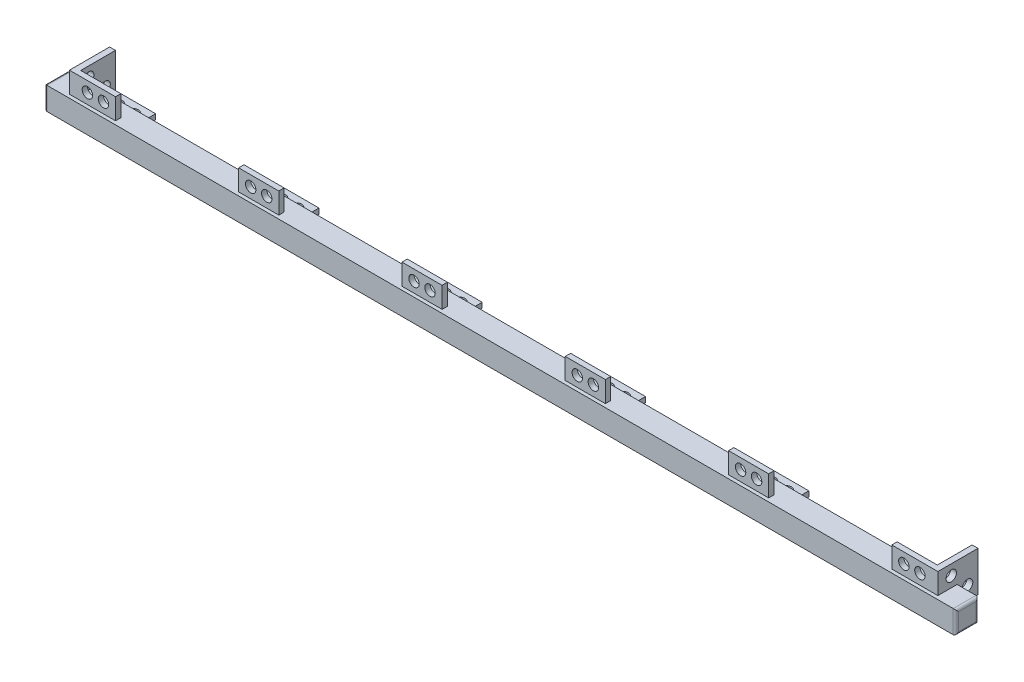
from build123d import *

# Parameters (mm, degrees)
SKETCH1_W           = 8.5
SKETCH1_H           = 8.5
BOSS_EXTRUDE1_DEPTH = 340.5
SKETCH2_W           = 15
SKETCH2_H           = 2
BOSS_EXTRUDE2_DEPTH = 7.8
SKETCH3_R           = 1.95
CUT_EXTRUDE1_DEPTH  = 7.8
SKETCH4_W           = 15
SKETCH4_H           = 2
BOSS_EXTRUDE3_DEPTH = 7.8
SKETCH5_R           = 1.95
CUT_EXTRUDE2_DEPTH  = 7.8
FILLET1_R           = 1
FILLET3_R           = 1
BOSS_EXTRUDE5_DEPTH = 2.2
BOSS_EXTRUDE6_DEPTH = 2.2
SKETCH9_R           = 1.95
CUT_EXTRUDE3_DEPTH  = 350


with BuildPart() as part:
    # Sketch1 → Boss-Extrude1 (new body)
    with BuildSketch(Plane(origin=(0, 0, 0), x_dir=(0, 0, -1), z_dir=(1, 0, 0))):
        with Locations((4.25, 4.25)):
            Rectangle(SKETCH1_W, SKETCH1_H)
    extrude(amount=BOSS_EXTRUDE1_DEPTH)

    # Sketch2 → Boss-Extrude2 (add)
    with BuildSketch(Plane(origin=(0, 8.5, 0), x_dir=(1, 0, 0), z_dir=(0, 1, 0))):
        with Locations((17.75, 2.3)):
            Rectangle(SKETCH2_W, SKETCH2_H)
        with Locations((78.75, 2.3)):
            Rectangle(SKETCH2_W, SKETCH2_H)
        with Locations((139.75, 2.3)):
            Rectangle(SKETCH2_W, SKETCH2_H)
        with Locations((200.75, 2.3)):
            Rectangle(SKETCH2_W, SKETCH2_H)
        with Locations((261.75, 2.3)):
            Rectangle(SKETCH2_W, SKETCH2_H)
        with Locations((322.75, 2.3)):
            Rectangle(SKETCH2_W, SKETCH2_H)
    extrude(amount=BOSS_EXTRUDE2_DEPTH)

    # Sketch3 → Cut-Extrude1 (cut)
    with BuildSketch(Plane.XY.offset(-1.3)):
        with Locations((14.75, 12.4)):
            Circle(SKETCH3_R)
        with Locations((20.75, 12.4)):
            Circle(SKETCH3_R)
        with Locations((75.75, 12.4)):
            Circle(SKETCH3_R)
        with Locations((81.75, 12.4)):
            Circle(SKETCH3_R)
        with Locations((136.75, 12.4)):
            Circle(SKETCH3_R)
        with Locations((142.75, 12.4)):
            Circle(SKETCH3_R)
        with Locations((197.75, 12.4)):
            Circle(SKETCH3_R)
        with Locations((203.75, 12.4)):
            Circle(SKETCH3_R)
        with Locations((258.75, 12.4)):
            Circle(SKETCH3_R)
        with Locations((264.75, 12.4)):
            Circle(SKETCH3_R)
        with Locations((319.75, 12.4)):
            Circle(SKETCH3_R)
        with Locations((325.75, 12.4)):
            Circle(SKETCH3_R)
    extrude(amount=-CUT_EXTRUDE1_DEPTH, mode=Mode.SUBTRACT)

    # Sketch4 → Boss-Extrude3 (add)
    with BuildSketch(Plane(origin=(0, 0, -8.5), x_dir=(-1, 0, 0), z_dir=(0, 0, -1))):
        with Locations((-261.75, 2.3)):
            Rectangle(SKETCH4_W, SKETCH4_H)
        with Locations((-322.75, 2.3)):
            Rectangle(SKETCH4_W, SKETCH4_H)
        with Locations((-200.75, 2.3)):
            Rectangle(SKETCH4_W, SKETCH4_H)
        with Locations((-139.75, 2.3)):
            Rectangle(SKETCH4_W, SKETCH4_H)
        with Locations((-78.75, 2.3)):
            Rectangle(SKETCH4_W, SKETCH4_H)
        with Locations((-17.75, 2.3)):
            Rectangle(SKETCH4_W, SKETCH4_H)
    extrude(amount=BOSS_EXTRUDE3_DEPTH)

    # Sketch5 → Cut-Extrude2 (cut)
    with BuildSketch(Plane.XZ.offset(-1.3)):
        with Locations(Location((264.75, -12.4, 0), (0, 0, 270))):
            Circle(SKETCH5_R)
        with Locations(Location((258.75, -12.4, 0), (0, 0, 270))):
            Circle(SKETCH5_R)
        with Locations(Location((203.75, -12.4, 0), (0, 0, 270))):
            Circle(SKETCH5_R)
        with Locations(Location((197.75, -12.4, 0), (0, 0, 270))):
            Circle(SKETCH5_R)
        with Locations(Location((142.75, -12.4, 0), (0, 0, 270))):
            Circle(SKETCH5_R)
        with Locations(Location((136.75, -12.4, 0), (0, 0, 270))):
            Circle(SKETCH5_R)
        with Locations(Location((20.75, -12.4, 0), (0, 0, 270))):
            Circle(SKETCH5_R)
        with Locations(Location((14.75, -12.4, 0), (0, 0, 270))):
            Circle(SKETCH5_R)
        with Locations(Location((81.75, -12.4, 0), (0, 0, 270))):
            Circle(SKETCH5_R)
        with Locations(Location((75.75, -12.4, 0), (0, 0, 270))):
            Circle(SKETCH5_R)
        with Locations(Location((325.75, -12.4, 0), (0, 0, 270))):
            Circle(SKETCH5_R)
        with Locations(Location((319.75, -12.4, 0), (0, 0, 270))):
            Circle(SKETCH5_R)
    extrude(amount=-CUT_EXTRUDE2_DEPTH, mode=Mode.SUBTRACT)

    # Fillet1
    fillet1_edges = [part.edges().sort_by_distance(p)[0] for p in [
        (340.5, 4.25, -8.5),
        (340.5, 8.5, -4.25),
        (340.5, 4.25, 0),
        (340.5, 0, -4.25),
    ]]
    fillet(fillet1_edges, radius=FILLET1_R)

    # Fillet3
    fillet3_edges = [part.edges().sort_by_distance(p)[0] for p in [
        (0, 8.5, -4.25),
        (0, 4.25, -8.5),
        (0, 0, -4.25),
        (0, 4.25, 0),
    ]]
    fillet(fillet3_edges, radius=FILLET3_R)

    # Sketch7 → Boss-Extrude5 (add)
    with BuildSketch(Plane(origin=(330.25, 0, 0), x_dir=(0, 0, -1), z_dir=(1, 0, 0))):
        Polygon((1.3, 8.5), (8.5, 8.5), (8.5, 1.3), (16.3, 1.3), (16.3, 16.3), (1.3, 16.3), align=None)
    extrude(amount=BOSS_EXTRUDE5_DEPTH)

    # Sketch8 → Boss-Extrude6 (add)
    with BuildSketch(Plane.ZY.offset(-10.25)):
        Polygon((-1.3, 16.3), (-16.3, 16.3), (-16.3, 1.3), (-8.5, 1.3), (-8.5, 8.5), (-1.3, 8.5), align=None)
    extrude(amount=BOSS_EXTRUDE6_DEPTH)

    # Sketch9 → Cut-Extrude3 (cut)
    with BuildSketch(Plane.ZY.offset(-8.05)):
        with Locations((-12.4, 6.3)):
            Circle(SKETCH9_R)
        with Locations((-6.3, 12.4)):
            Circle(SKETCH9_R)
    extrude(amount=-CUT_EXTRUDE3_DEPTH, mode=Mode.SUBTRACT)


solid = part.part
